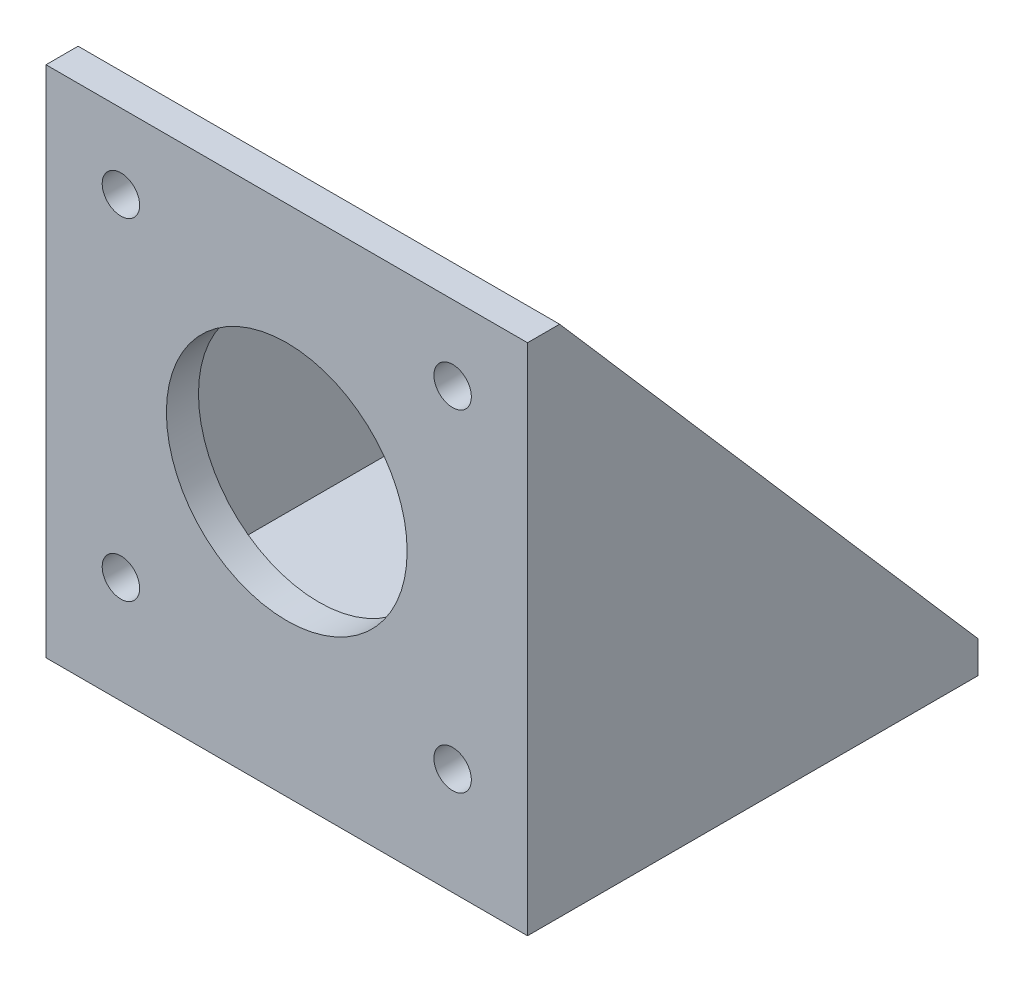
from build123d import *

# Parameters (mm, degrees)
SKETCH1_W           = 45
SKETCH1_H           = 42.1
BOSS_EXTRUDE1_DEPTH = 3
SKETCH2_W           = 45
SKETCH2_H           = 3
BOSS_EXTRUDE2_DEPTH = 45
SKETCH4_R           = 11.25
CUT_EXTRUDE1_DEPTH  = 66.871541655
SKETCH5_R           = 1.75
CUT_EXTRUDE2_DEPTH  = 66.871541655
SKETCH6_R           = 1.55
CUT_EXTRUDE3_DEPTH  = 3
BOSS_EXTRUDE3_DEPTH = 2.5


with BuildPart() as part:
    # Sketch1 → Boss-Extrude1 (new body)
    with BuildSketch(Plane(origin=(0, 0, 0), x_dir=(1, 0, 0), z_dir=(0, 1, 0))):
        Rectangle(SKETCH1_W, SKETCH1_H)
    extrude(amount=BOSS_EXTRUDE1_DEPTH)

    # Sketch2 → Boss-Extrude2 (add)
    with BuildSketch(Plane.XZ.offset(-3)):
        with Locations((0, 19.55)):
            Rectangle(SKETCH2_W, SKETCH2_H)
    extrude(amount=-BOSS_EXTRUDE2_DEPTH)

    # Sketch4 → Cut-Extrude1 (cut, through all)
    with BuildSketch(Plane(origin=(0, 0, 18.05), x_dir=(-1, 0, 0), z_dir=(0, 0, -1))):
        with Locations((0, 25.5)):
            Circle(SKETCH4_R)
    extrude(amount=-CUT_EXTRUDE1_DEPTH, mode=Mode.SUBTRACT)

    # Sketch5 → Cut-Extrude2 (cut, through all)
    with BuildSketch(Plane(origin=(0, 0, 18.05), x_dir=(-1, 0, 0), z_dir=(0, 0, -1))):
        with Locations((-15.5, 41)):
            Circle(SKETCH5_R)
        with Locations((15.5, 41)):
            Circle(SKETCH5_R)
        with Locations((15.5, 10)):
            Circle(SKETCH5_R)
        with Locations((-15.5, 10)):
            Circle(SKETCH5_R)
    extrude(amount=-CUT_EXTRUDE2_DEPTH, mode=Mode.SUBTRACT)

    # Sketch6 → Cut-Extrude3 (cut)
    with BuildSketch(Plane(origin=(0, 3, 0), x_dir=(1, 0, 0), z_dir=(0, 1, 0))):
        with Locations(Location((12.5, -10, 0), (0, 0, 270))):
            Circle(SKETCH6_R)
        with Locations(Location((-12.5, -10, 0), (0, 0, 270))):
            Circle(SKETCH6_R)
        with Locations(Location((-12.5, 10, 0), (0, 0, 270))):
            Circle(SKETCH6_R)
        with Locations(Location((12.5, 10, 0), (0, 0, 270))):
            Circle(SKETCH6_R)
    extrude(amount=-CUT_EXTRUDE3_DEPTH, mode=Mode.SUBTRACT)

    # Sketch8 → Boss-Extrude3 (add)
    with BuildSketch(Plane(origin=(22.5, 0, 0), x_dir=(0, 0, -1), z_dir=(1, 0, 0))):
        Polygon((-18.05, 48), (21.05, 3), (-18.05, 3), align=None)
    boss_extrude3 = extrude(amount=-BOSS_EXTRUDE3_DEPTH)

    # Mirror1: Boss-Extrude3 across plane
    add(boss_extrude3.mirror(Plane(origin=(0, 0, 0), x_dir=(0, 0, 1), z_dir=(1, 0, 0))))


solid = part.part
